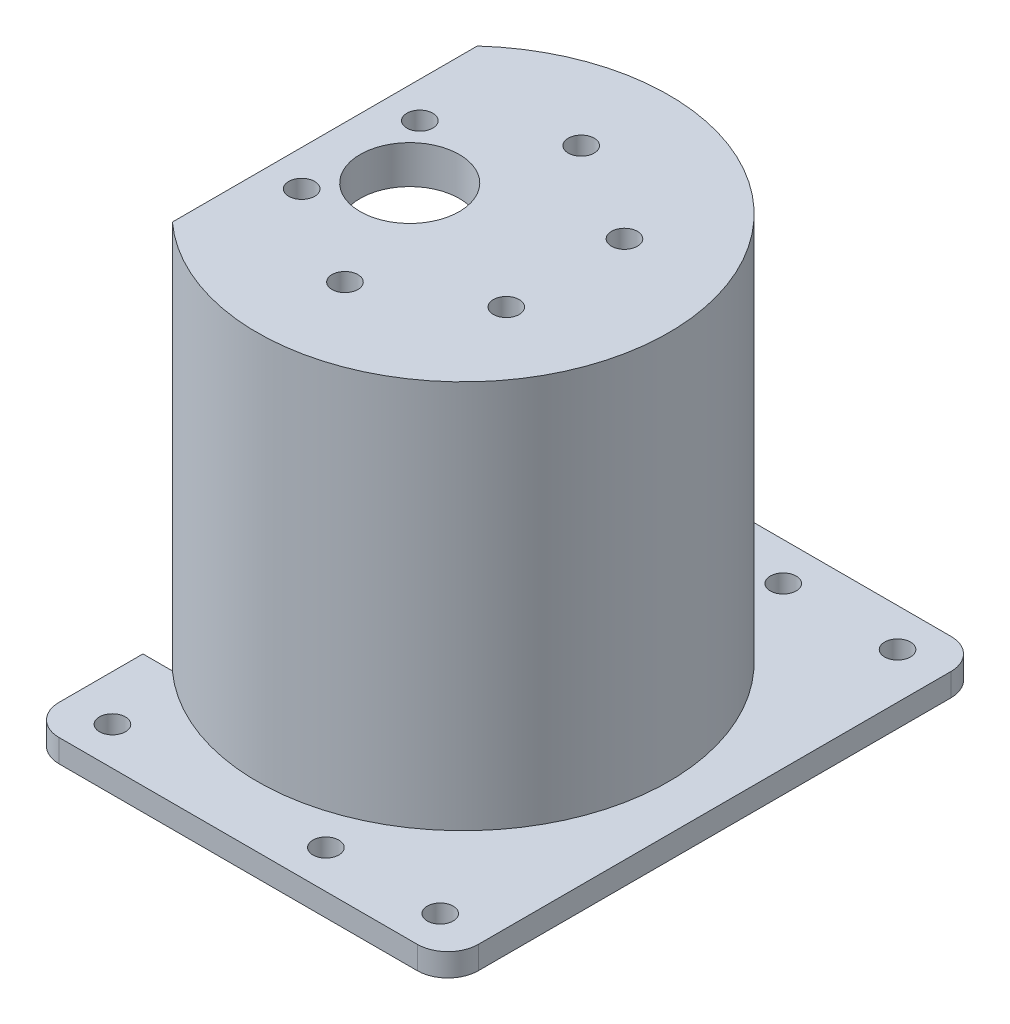
from build123d import *

# Parameters (mm, degrees)
DODANIE_WYCI_GNI_CIE1_DEPTH = 3
DODANIE_WYCI_GNI_CIE2_DEPTH = 51
DODANIE_WYCI_GNI_CIE3_START = -5
DODANIE_WYCI_GNI_CIE3_DEPTH = 5
SZKIC4_R                    = 1.7
WYTNIJ_WYCI_GNI_CIE1_DEPTH  = 5
SZKIC5_R                    = 6.5
SZKIC5_R_2                  = 1.7
WYTNIJ_WYCI_GNI_CIE2_DEPTH  = 5


with BuildPart() as part:
    # Szkic1 → Dodanie-wyciągnięcie1 (new body)
    with BuildSketch(Plane(origin=(0, 0, 0), x_dir=(1, 0, 0), z_dir=(0, 1, 0))):
        with BuildLine():
            Line((-27.5, 20), (-12.5, 20))
            ThreePointArc((-12.5, 20), (-11.934314575, 20.040202025), (-11.38, 20.16))
            ThreePointArc((-11.38, 20.16), (15.5, 0), (-11.38, -20.16))
            ThreePointArc((-11.38, -20.16), (-11.934314575, -20.040202025), (-12.5, -20))
            Line((-12.5, -20), (-27.5, -20))
            Line((-27.5, -20), (-27.5, -31))
            ThreePointArc((-27.5, -31), (-26.328427125, -33.828427125), (-23.5, -35))
            Line((-23.5, -35), (23.5, -35))
            ThreePointArc((23.5, -35), (26.328427125, -33.828427125), (27.5, -31))
            Line((27.5, -31), (27.5, 31))
            ThreePointArc((27.5, 31), (26.328427125, 33.828427125), (23.5, 35))
            Line((23.5, 35), (-23.5, 35))
            ThreePointArc((-23.5, 35), (-26.328427125, 33.828427125), (-27.5, 31))
            Line((-27.5, 31), (-27.5, 20))
        make_face()
    extrude(amount=DODANIE_WYCI_GNI_CIE1_DEPTH)

    # Szkic2 → Dodanie-wyciągnięcie2 (add)
    with BuildSketch(Plane(origin=(0, 3, 0), x_dir=(1, 0, 0), z_dir=(0, 1, 0))):
        with BuildLine():
            Line((-12.5, -20), (-23.638357147, -20))
            ThreePointArc((-23.638357147, -20), (21.5, 0), (-23.638357147, 20))
            Line((-23.638357147, 20), (-12.5, 20))
            ThreePointArc((-12.5, 20), (-11.934314575, 20.040202025), (-11.38, 20.16))
            ThreePointArc((-11.38, 20.16), (15.5, 0), (-11.38, -20.16))
            ThreePointArc((-11.38, -20.16), (-11.934314575, -20.040202025), (-12.5, -20))
        make_face()
    extrude(amount=DODANIE_WYCI_GNI_CIE2_DEPTH)

    # Szkic3 → Dodanie-wyciągnięcie3 (add)
    with BuildSketch(Plane(origin=(0, 54, 0), x_dir=(1, 0, 0), z_dir=(0, 1, 0)).offset(DODANIE_WYCI_GNI_CIE3_START)):
        with BuildLine():
            Line((-23.638357147, 20), (-23.638357147, -20))
            ThreePointArc((-23.638357147, -20), (21.5, 0), (-23.638357147, 20))
        make_face()
    extrude(amount=DODANIE_WYCI_GNI_CIE3_DEPTH)

    # Szkic4 → Wytnij-wyciągnięcie1 (cut)
    with BuildSketch(Plane(origin=(0, 3, 0), x_dir=(1, 0, 0), z_dir=(0, 1, 0))):
        with Locations(Location((-21.5, -30, 0), (0, 0, 270))):
            Circle(SZKIC4_R)
        with Locations(Location((21.5, -30, 0), (0, 0, 270))):
            Circle(SZKIC4_R)
        with Locations(Location((21.5, 30, 0), (0, 0, 270))):
            Circle(SZKIC4_R)
        with Locations(Location((-21.5, 30, 0), (0, 0, 270))):
            Circle(SZKIC4_R)
        with Locations(Location((6.5, -30, 0), (0, 0, 270))):
            Circle(SZKIC4_R)
        with Locations(Location((6.5, 30, 0), (0, 0, 270))):
            Circle(SZKIC4_R)
    extrude(amount=-WYTNIJ_WYCI_GNI_CIE1_DEPTH, mode=Mode.SUBTRACT)

    # Szkic5 → Wytnij-wyciągnięcie2 (cut)
    with BuildSketch(Plane(origin=(0, 54, 0), x_dir=(1, 0, 0), z_dir=(0, 1, 0))):
        with Locations(Location((-12.5, 0, 0), (0, 0, 270))):
            Circle(SZKIC5_R)
        with Locations(Location((-5.5, -15.5, 0), (0, 0, 270))):
            Circle(SZKIC5_R_2)
        with Locations(Location((-18.923393759, -7.75, 0), (0, 0, 270))):
            Circle(SZKIC5_R_2)
        with Locations(Location((-18.923393759, 7.75, 0), (0, 0, 270))):
            Circle(SZKIC5_R_2)
        with Locations(Location((-5.5, 15.5, 0), (0, 0, 270))):
            Circle(SZKIC5_R_2)
        with Locations(Location((7.923393759, 7.75, 0), (0, 0, 270))):
            Circle(SZKIC5_R_2)
        with Locations(Location((7.923393759, -7.75, 0), (0, 0, 270))):
            Circle(SZKIC5_R_2)
    extrude(amount=-WYTNIJ_WYCI_GNI_CIE2_DEPTH, mode=Mode.SUBTRACT)


solid = part.part
